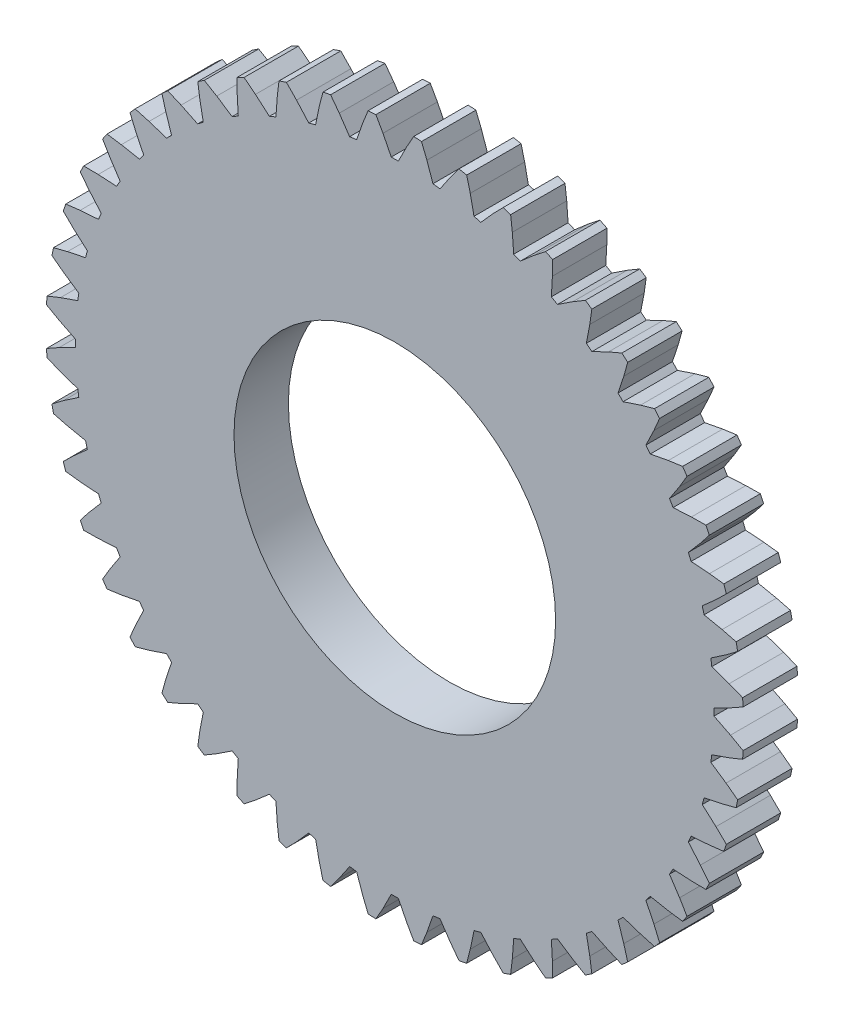
from build123d import *

# Parameters (mm, degrees)
CROQUIS1_R              = 7.375
SALIENTE_EXTRUIR1_DEPTH = 1.15
CORTAR_EXTRUIR1_DEPTH   = 1.3
MATRIZC1_COUNT          = 48
CROQUIS2_3_R            = 3.4
CORTAR_EXTRUIR2_DEPTH   = 2.1


with BuildPart() as part:
    # Croquis1 → Saliente-Extruir1 (new body)
    with BuildSketch(Plane.XY):
        Circle(CROQUIS1_R)
    extrude(amount=SALIENTE_EXTRUIR1_DEPTH)

    # Croquis2 → Cortar-Extruir1 (cut)
    with BuildSketch(Plane.XY.offset(1.15)):
        with BuildLine():
            ThreePointArc((-0.075, 6.74958332), (0, 6.75), (0.075, 6.74958332))
            Line((0.075, 6.74958332), (0.25, 7.097377716))
            Line((0.25, 7.097377716), (0.476389994, 7.5))
            Line((0.476389994, 7.5), (-0.476389994, 7.5))
            Line((-0.476389994, 7.5), (-0.25, 7.097377716))
            Line((-0.25, 7.097377716), (-0.075, 6.74958332))
        make_face()
    cortar_extruir1 = extrude(amount=-CORTAR_EXTRUIR1_DEPTH, mode=Mode.SUBTRACT)

    # MatrizC1: Cortar-Extruir1 ×48 about axis
    matrizc1_axis = Axis((0, 0, 0), (0, 0, 1))
    for i in range(1, MATRIZC1_COUNT):
        add(cortar_extruir1.rotate(matrizc1_axis, i * 360 / MATRIZC1_COUNT), mode=Mode.SUBTRACT)

    # Croquis2<3> → Cortar-Extruir2 (cut)
    with BuildSketch(Plane.XY.offset(1.15)):
        Circle(CROQUIS2_3_R)
    extrude(amount=-CORTAR_EXTRUIR2_DEPTH, mode=Mode.SUBTRACT)


solid = part.part
